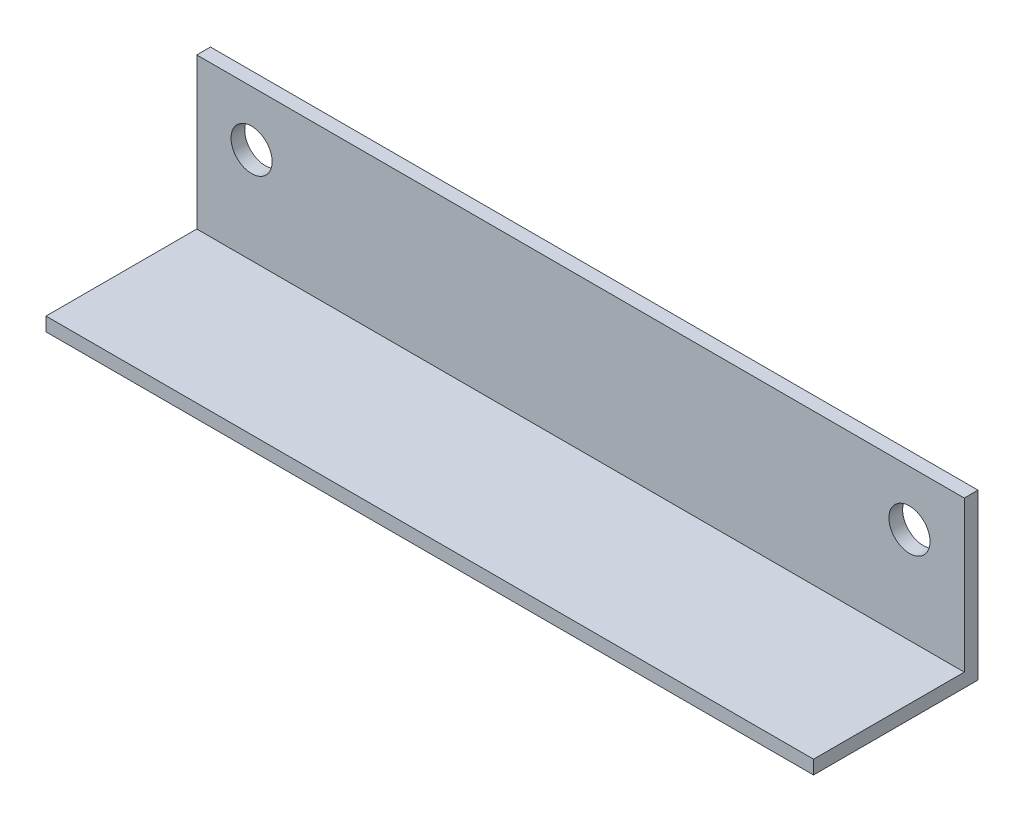
from build123d import *

# Parameters (mm, degrees)
EXTRUDE_THIN1_DEPTH = 88.9
CUT_EXTRUDE1_REACH  = 105.954
SKETCH2_R           = 4.7625


with BuildPart() as part:
    # Sketch1 → Extrude-Thin1 (new, symmetric)
    with BuildSketch(Plane(origin=(0, 0, 0), x_dir=(0, 0, -1), z_dir=(1, 0, 0))):
        Polygon((-38.1, 0), (0, 0), (0, 38.1), (-3.175, 38.1), (-3.175, 3.175), (-38.1, 3.175), align=None)
    extrude(amount=EXTRUDE_THIN1_DEPTH, both=True)

    # Sketch2 → Cut-Extrude1 (cut, up to next)
    with BuildSketch(Plane(origin=(0, 0, 0), x_dir=(-1, 0, 0), z_dir=(0, 0, -1)), mode=Mode.PRIVATE) as cut_extrude1_sk1:
        with Locations((-76.2, 25.4)):
            Circle(SKETCH2_R)
    cut_extrude1_tool1 = extrude(cut_extrude1_sk1.sketch, amount=-CUT_EXTRUDE1_REACH, mode=Mode.PRIVATE) & part.part
    # Sketch2 → Cut-Extrude1 (cut, up to next)
    with BuildSketch(Plane(origin=(0, 0, 0), x_dir=(-1, 0, 0), z_dir=(0, 0, -1)), mode=Mode.PRIVATE) as cut_extrude1_sk2:
        with Locations((76.2, 25.4)):
            Circle(SKETCH2_R)
    cut_extrude1_tool2 = extrude(cut_extrude1_sk2.sketch, amount=-CUT_EXTRUDE1_REACH, mode=Mode.PRIVATE) & part.part
    add(cut_extrude1_tool1.solids().sort_by_distance((76.2, 25.4, 0))[0], mode=Mode.SUBTRACT)
    add(cut_extrude1_tool2.solids().sort_by_distance((-76.2, 25.4, 0))[0], mode=Mode.SUBTRACT)


solid = part.part
